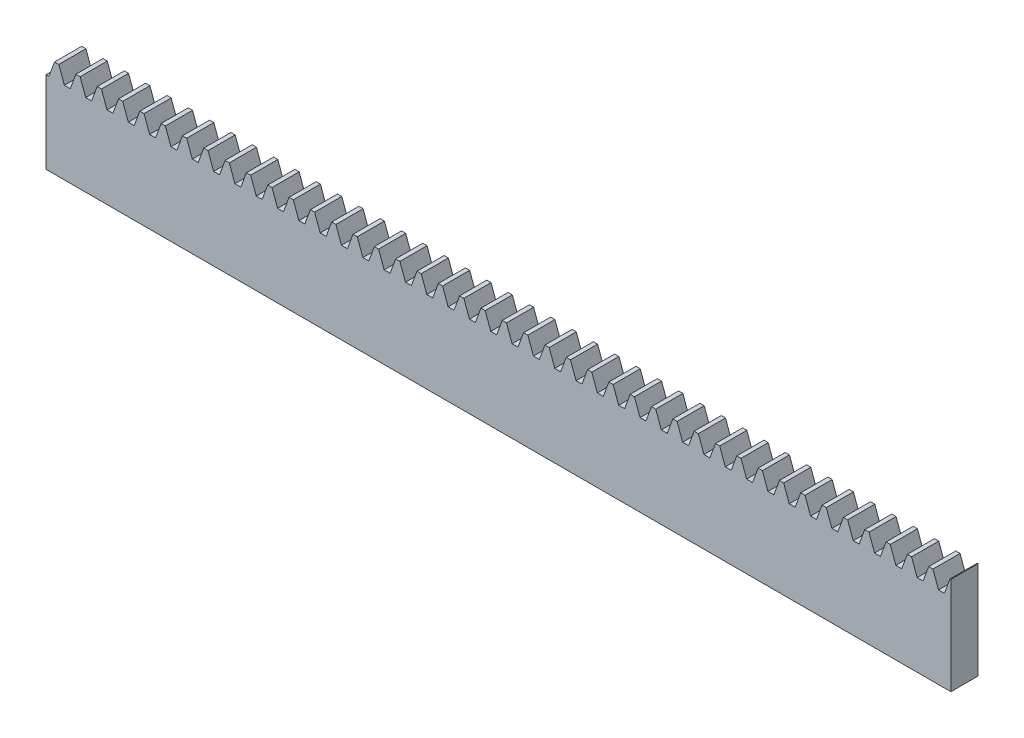
from build123d import *

# Parameters (mm, degrees)
BLANKSKE_W        = 400
BLANKSKE_H        = 43
BLANK_DEPTH       = 12
TOOTHCUTSIM_DEPTH = 403.483540036
TEETHCUTS_COUNT   = 43
TEETHCUTS_PITCH   = 9.42477795


with BuildPart() as part:
    # BlankSke → Blank (new body)
    with BuildSketch(Plane.XY):
        with Locations((200, 21.5)):
            Rectangle(BLANKSKE_W, BLANKSKE_H)
    extrude(amount=-BLANK_DEPTH)

    # TooCutSkeSim → ToothCutSim (cut, through all)
    with BuildSketch(Plane.XY):
        Polygon((1.312306109, 36.25), (-1.312306109, 36.25), (-3.778350034, 43.0254), (3.778350034, 43.0254), align=None)
    toothcutsim = extrude(amount=-TOOTHCUTSIM_DEPTH, mode=Mode.SUBTRACT)

    # TeethCuts: ToothCutSim ×43
    with Locations(*[(i * TEETHCUTS_PITCH, 0, 0) for i in range(1, TEETHCUTS_COUNT)]):
        add(toothcutsim, mode=Mode.SUBTRACT)


solid = part.part
